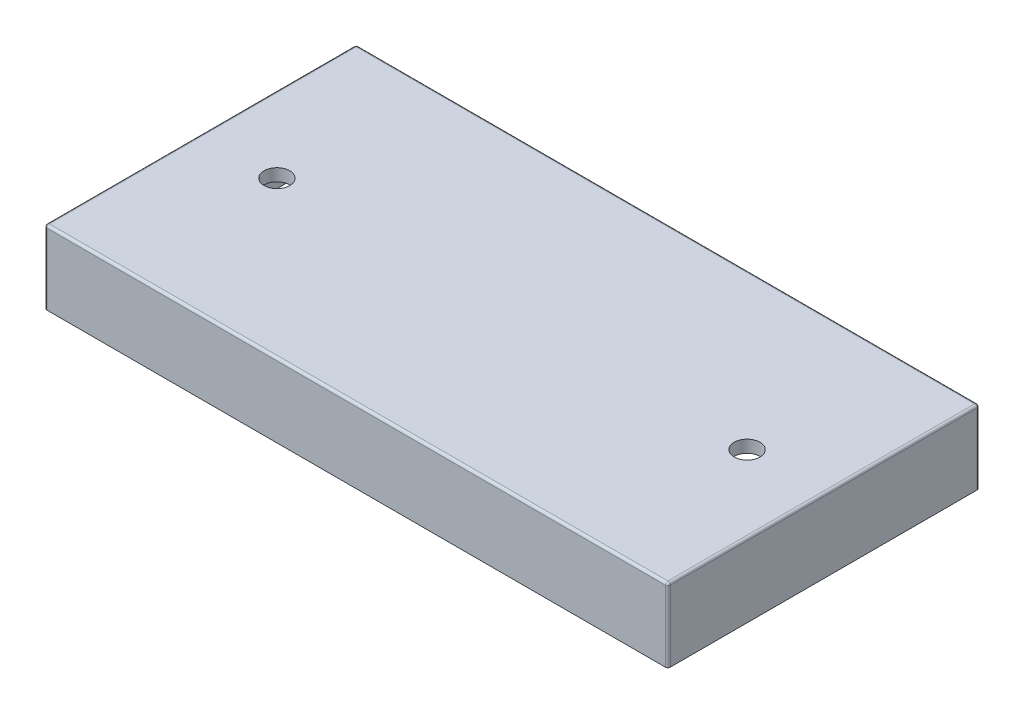
from build123d import *

# Parameters (mm, degrees)
SKETCH1_W             = 101.8
SKETCH1_H             = 50.9
SKETCH1_W_2           = 97.8
SKETCH1_H_2           = 46.9
MAIN_BODY_DEPTH       = 10
SKETCH4_W             = 101.8
SKETCH4_H             = 50.9
TOP_DEPTH             = 2
OUTER_FILLET_0_2MM_R  = 0.4
INNER_FILLET_1MM_R    = 1
HOLES_CUT_4_2MM_REACH = 60.159
SKETCH6_R             = 2.1


with BuildPart() as part:
    # Sketch1 → Main Body (new body)
    with BuildSketch(Plane(origin=(0, 0, 0), x_dir=(1, 0, 0), z_dir=(0, 1, 0))):
        Rectangle(SKETCH1_W, SKETCH1_H)
        Rectangle(SKETCH1_W_2, SKETCH1_H_2, mode=Mode.SUBTRACT)
    extrude(amount=MAIN_BODY_DEPTH)

    # Sketch4 → Top (add)
    with BuildSketch(Plane(origin=(0, 10, 0), x_dir=(1, 0, 0), z_dir=(0, 1, 0))):
        Rectangle(SKETCH4_W, SKETCH4_H)
    extrude(amount=TOP_DEPTH)

    # Outer Fillet 0.2mm
    outer_fillet_0_2mm_edges = [part.edges().sort_by_distance(p)[0] for p in [
        (0, 12, -25.45),
        (-50.9, 12, 0),
        (0, 12, 25.45),
        (50.9, 12, 0),
        (-50.9, 6, -25.45),
        (50.9, 6, -25.45),
        (50.9, 6, 25.45),
        (-50.9, 6, 25.45),
    ]]
    fillet(outer_fillet_0_2mm_edges, radius=OUTER_FILLET_0_2MM_R)

    # Inner Fillet 1mm
    inner_fillet_1mm_edges = [part.edges().sort_by_distance(p)[0] for p in [
        (48.9, 5, -23.45),
        (-48.9, 5, -23.45),
        (-48.9, 5, 23.45),
        (48.9, 5, 23.45),
        (0, 10, -23.45),
        (-48.9, 10, 0),
        (0, 10, 23.45),
        (48.9, 10, 0),
    ]]
    fillet(inner_fillet_1mm_edges, radius=INNER_FILLET_1MM_R)

    # Sketch6 → Holes Cut 4.2mm (cut, up to next)
    with BuildSketch(Plane(origin=(0, 12, 0), x_dir=(1, 0, 0), z_dir=(0, 1, 0)), mode=Mode.PRIVATE) as holes_cut_4_2mm_sk1:
        with Locations(Location((-38.4, 0, 0), (0, 0, 270))):
            Circle(SKETCH6_R)
    holes_cut_4_2mm_tool1 = extrude(holes_cut_4_2mm_sk1.sketch, amount=-HOLES_CUT_4_2MM_REACH, mode=Mode.PRIVATE) & part.part
    # Sketch6 → Holes Cut 4.2mm (cut, up to next)
    with BuildSketch(Plane(origin=(0, 12, 0), x_dir=(1, 0, 0), z_dir=(0, 1, 0)), mode=Mode.PRIVATE) as holes_cut_4_2mm_sk2:
        with Locations(Location((38.4, 0, 0), (0, 0, 270))):
            Circle(SKETCH6_R)
    holes_cut_4_2mm_tool2 = extrude(holes_cut_4_2mm_sk2.sketch, amount=-HOLES_CUT_4_2MM_REACH, mode=Mode.PRIVATE) & part.part
    add(holes_cut_4_2mm_tool1.solids().sort_by_distance((-38.4, 12, 0))[0], mode=Mode.SUBTRACT)
    add(holes_cut_4_2mm_tool2.solids().sort_by_distance((38.4, 12, 0))[0], mode=Mode.SUBTRACT)


solid = part.part
